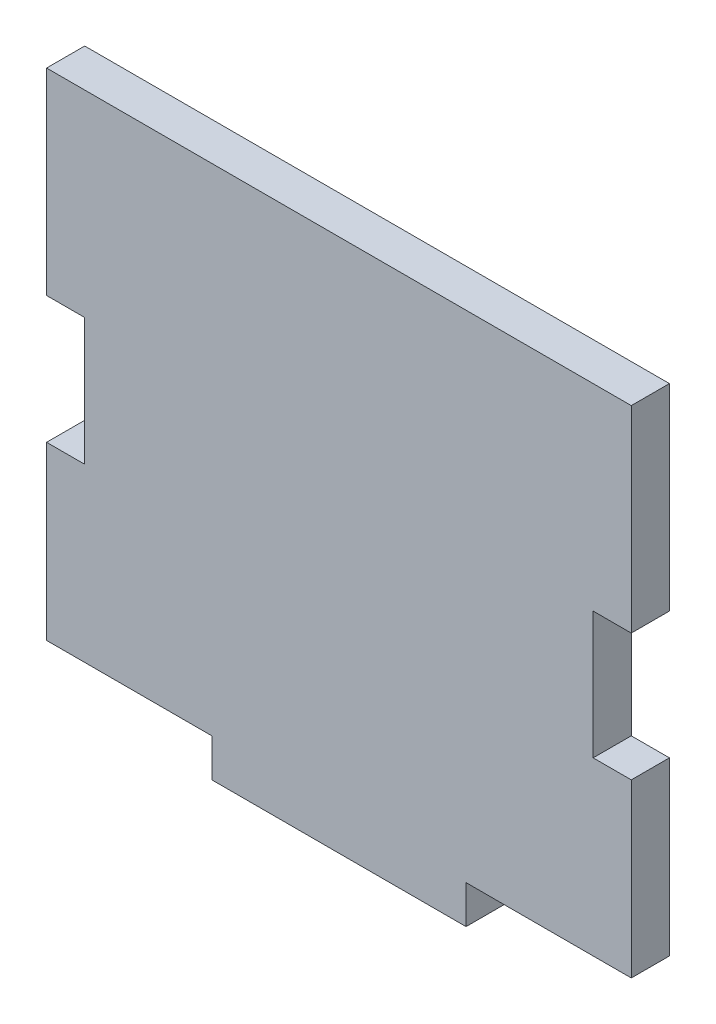
from build123d import *

# Parameters (mm, degrees)
SKETCH1_W           = 46
SKETCH1_H           = 42
BOSS_EXTRUDE1_DEPTH = 3
SKETCH2_W           = 13
SKETCH2_H           = 3
CUT_EXTRUDE1_DEPTH  = 32.288975694
SKETCH3_W           = 3
SKETCH3_H           = 10
CUT_EXTRUDE2_DEPTH  = 32.288975694


with BuildPart() as part:
    # Sketch1 → Boss-Extrude1 (new body)
    with BuildSketch(Plane.XY):
        Rectangle(SKETCH1_W, SKETCH1_H)
    extrude(amount=BOSS_EXTRUDE1_DEPTH)

    # Sketch2 → Cut-Extrude1 (cut, through all)
    with BuildSketch(Plane.XY.offset(3)):
        with Locations((-16.5, -19.5)):
            Rectangle(SKETCH2_W, SKETCH2_H)
        with Locations((16.5, -19.5)):
            Rectangle(SKETCH2_W, SKETCH2_H)
    extrude(amount=-CUT_EXTRUDE1_DEPTH, mode=Mode.SUBTRACT)

    # Sketch3 → Cut-Extrude2 (cut, through all)
    with BuildSketch(Plane(origin=(0, 0, 0), x_dir=(-1, 0, 0), z_dir=(0, 0, -1))):
        with Locations((-21.5, 0.5)):
            Rectangle(SKETCH3_W, SKETCH3_H)
        with Locations((21.5, 0.5)):
            Rectangle(SKETCH3_W, SKETCH3_H)
    extrude(amount=-CUT_EXTRUDE2_DEPTH, mode=Mode.SUBTRACT)


solid = part.part
